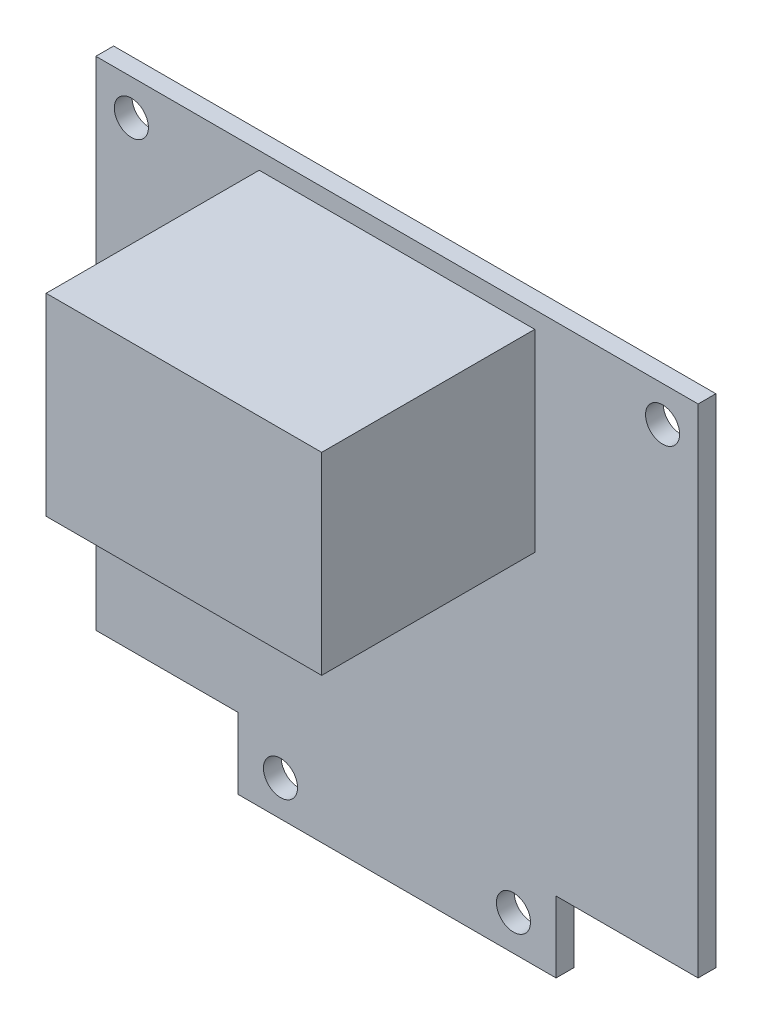
from build123d import *

# Parameters (mm, degrees)
SKETCH1_R           = 1.524
BOSS_EXTRUDE1_DEPTH = 1.5875
SKETCH2_W           = 24.638
SKETCH2_H           = 17.272
BOSS_EXTRUDE2_DEPTH = 19.05


with BuildPart() as part:
    # Sketch1 → Boss-Extrude1 (new body)
    with BuildSketch(Plane.XY):
        Polygon((-26.924, 25.4), (-26.924, -19.05), (-14.224, -19.05), (-14.224, -25.4), (14.224, -25.4), (14.224, -19.05), (26.924, -19.05), (26.924, 25.4), align=None)
        with Locations((-10.414, -22.225)):
            Circle(SKETCH1_R, mode=Mode.SUBTRACT)
        with Locations((10.414, -22.225)):
            Circle(SKETCH1_R, mode=Mode.SUBTRACT)
        with Locations((-23.749, 22.225)):
            Circle(SKETCH1_R, mode=Mode.SUBTRACT)
        with Locations((23.749, 22.225)):
            Circle(SKETCH1_R, mode=Mode.SUBTRACT)
    extrude(amount=BOSS_EXTRUDE1_DEPTH)

    # Sketch2 → Boss-Extrude2 (add)
    with BuildSketch(Plane.XY.offset(1.5875)):
        with Locations((0, 15.24)):
            Rectangle(SKETCH2_W, SKETCH2_H)
    extrude(amount=BOSS_EXTRUDE2_DEPTH)


solid = part.part
